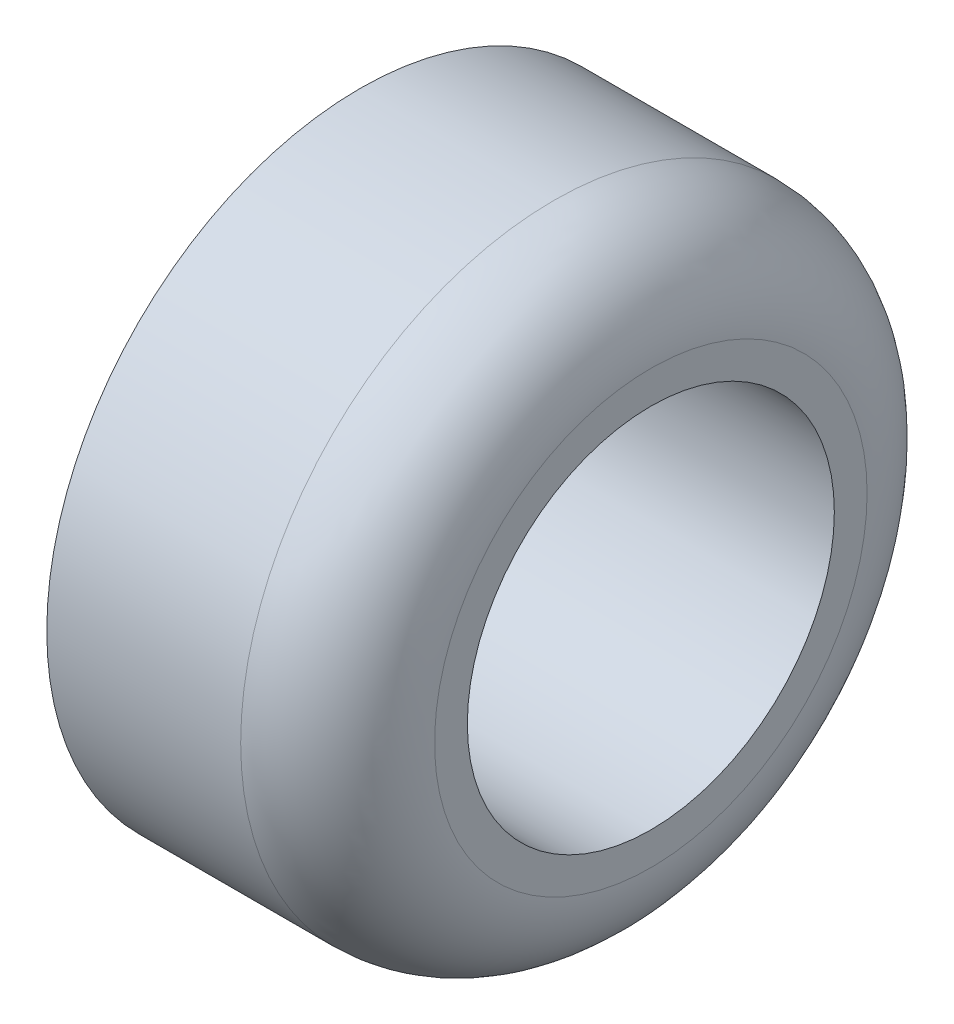
from build123d import *

# Parameters (mm, degrees)
SKETCH2_R           = 4.2672
SKETCH2_R_2         = 2.50000008
BOSS_EXTRUDE1_DEPTH = 3.9624
FILLET2_R           = 1.320798984


with BuildPart() as part:
    # Sketch2 → Boss-Extrude1 (new body)
    with BuildSketch(Plane(origin=(0, 0, 0), x_dir=(0, 0, -1), z_dir=(1, 0, 0))):
        Circle(SKETCH2_R)
        Circle(SKETCH2_R_2, mode=Mode.SUBTRACT)
    extrude(amount=-BOSS_EXTRUDE1_DEPTH)

    # Fillet2
    fillet2_edges = [part.edges().sort_by_distance(p)[0] for p in [
        (0, 0, 4.2672),
    ]]
    fillet(fillet2_edges, radius=FILLET2_R)


solid = part.part
